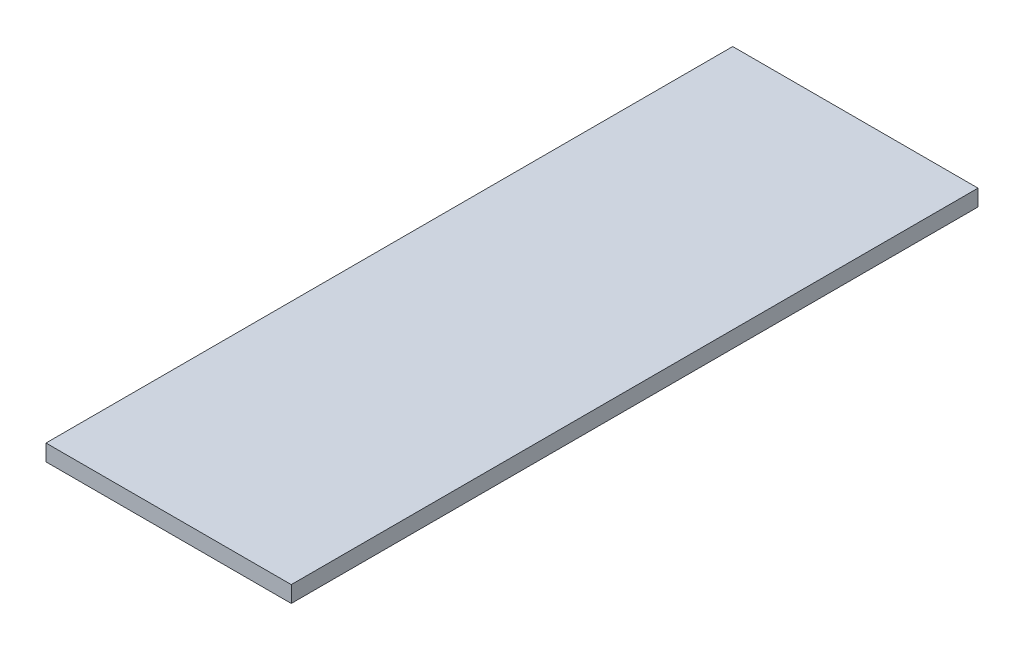
from build123d import *

# Parameters (mm, degrees)
SKETCH1_W           = 75
SKETCH1_H           = 210
BOSS_EXTRUDE1_DEPTH = 5


with BuildPart() as part:
    # Sketch1 → Boss-Extrude1 (new body)
    with BuildSketch(Plane(origin=(0, 0, 0), x_dir=(1, 0, 0), z_dir=(0, 1, 0))):
        with Locations((37.5, 105)):
            Rectangle(SKETCH1_W, SKETCH1_H)
    extrude(amount=BOSS_EXTRUDE1_DEPTH)


solid = part.part
